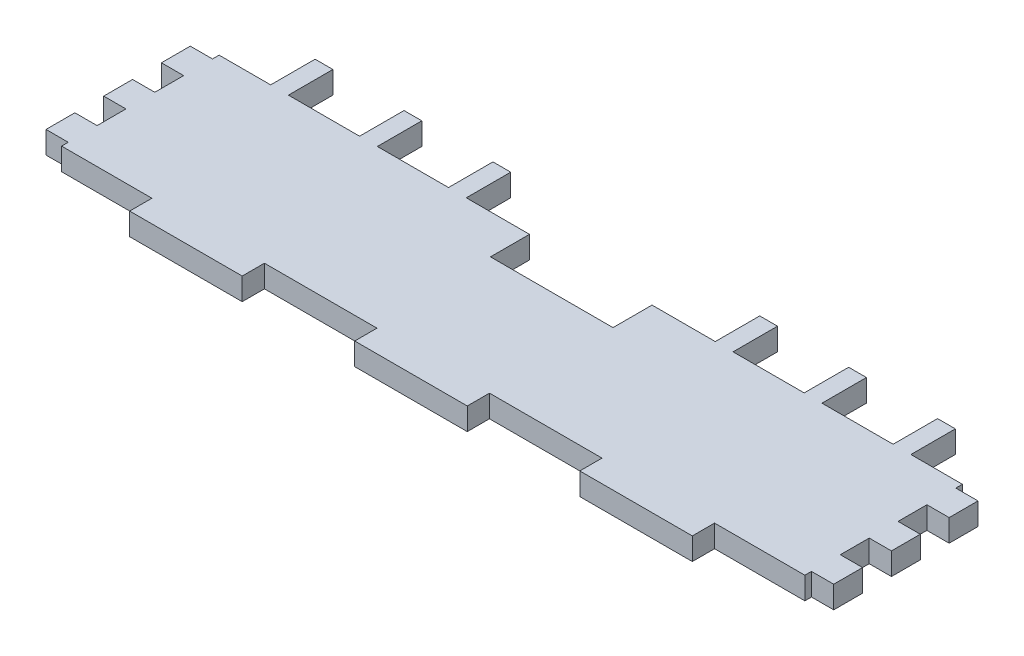
from build123d import *

# Parameters (mm, degrees)
SKETCH1_W           = 32.142857142
SKETCH1_H           = 6.35
SKETCH1_W_2         = 32.142857143
SKETCH1_W_3         = 6.35
SKETCH1_H_2         = 8.242857143
SKETCH1_H_3         = 8.242857142
BOSS_EXTRUDE1_DEPTH = 6.35
SKETCH2_W           = 212.3
SKETCH2_H           = 6.35
SKETCH2_W_2         = 5.08
BOSS_EXTRUDE2_DEPTH = 6.35
SKETCH3_W           = 35
SKETCH3_H           = 23.85
CUT_EXTRUDE1_DEPTH  = 235.025052078
SKETCH4_W           = 14.71
SKETCH4_H           = 6.35
SKETCH4_W_2         = 20.32
CUT_EXTRUDE2_DEPTH  = 6.35
SKETCH5_W           = 20.32
SKETCH5_H           = 6.35
SKETCH5_W_2         = 18.06
CUT_EXTRUDE3_DEPTH  = 235.025052078


with BuildPart() as part:
    # Sketch1 → Boss-Extrude1 (new body)
    with BuildSketch(Plane(origin=(0, 0, 0), x_dir=(1, 0, 0), z_dir=(0, 1, 0))):
        Polygon((6.35, 6.35), (32.142857143, 6.35), (64.285714286, 6.35), (96.428571429, 6.35), (128.571428571, 6.35), (160.714285714, 6.35), (192.857142857, 6.35), (218.65, 6.35), (218.65, 8.242857143), (218.65, 16.485714286), (218.65, 24.728571429), (218.65, 32.971428571), (218.65, 41.214285714), (218.65, 49.457142857), (218.65, 51.35), (192.857142857, 51.35), (160.714285714, 51.35), (128.571428571, 51.35), (96.428571429, 51.35), (64.285714286, 51.35), (32.142857143, 51.35), (6.35, 51.35), (6.35, 49.457142857), (6.35, 41.214285714), (6.35, 32.971428571), (6.35, 24.728571429), (6.35, 16.485714286), (6.35, 8.242857143), align=None)
        with Locations((112.5, 54.525)):
            Rectangle(SKETCH1_W, SKETCH1_H)
        with Locations((112.5, 3.175)):
            Rectangle(SKETCH1_W, SKETCH1_H)
        with Locations((176.785714286, 3.175)):
            Rectangle(SKETCH1_W_2, SKETCH1_H)
        with Locations((176.785714286, 54.525)):
            Rectangle(SKETCH1_W_2, SKETCH1_H)
        with Locations((48.214285715, 54.525)):
            Rectangle(SKETCH1_W_2, SKETCH1_H)
        with Locations((48.214285715, 3.175)):
            Rectangle(SKETCH1_W_2, SKETCH1_H)
        with Locations((3.175, 12.364285714)):
            Rectangle(SKETCH1_W_3, SKETCH1_H_2)
        with Locations((3.175, 28.85)):
            Rectangle(SKETCH1_W_3, SKETCH1_H_3)
        with Locations((3.175, 45.335714286)):
            Rectangle(SKETCH1_W_3, SKETCH1_H_2)
        with Locations((221.825, 12.364285714)):
            Rectangle(SKETCH1_W_3, SKETCH1_H_2)
        with Locations((221.825, 28.85)):
            Rectangle(SKETCH1_W_3, SKETCH1_H_3)
        with Locations((221.825, 45.335714286)):
            Rectangle(SKETCH1_W_3, SKETCH1_H_2)
    extrude(amount=BOSS_EXTRUDE1_DEPTH)

    # Sketch2 → Boss-Extrude2 (add)
    with BuildSketch(Plane(origin=(0, 6.35, 0), x_dir=(1, 0, 0), z_dir=(0, 1, 0))):
        with Locations((112.5, 54.525)):
            Rectangle(SKETCH2_W, SKETCH2_H)
        with Locations((23.6, 60.875)):
            Rectangle(SKETCH2_W_2, SKETCH2_H)
        with Locations((49, 60.875)):
            Rectangle(SKETCH2_W_2, SKETCH2_H)
        with Locations((74.4, 60.875)):
            Rectangle(SKETCH2_W_2, SKETCH2_H)
        with Locations((99.8, 60.875)):
            Rectangle(SKETCH2_W_2, SKETCH2_H)
        with Locations((201.4, 60.875)):
            Rectangle(SKETCH2_W_2, SKETCH2_H)
        with Locations((176, 60.875)):
            Rectangle(SKETCH2_W_2, SKETCH2_H)
        with Locations((125.2, 60.875)):
            Rectangle(SKETCH2_W_2, SKETCH2_H)
        with Locations((150.6, 60.875)):
            Rectangle(SKETCH2_W_2, SKETCH2_H)
    extrude(amount=-BOSS_EXTRUDE2_DEPTH)

    # Sketch3 → Cut-Extrude1 (cut, through all)
    with BuildSketch(Plane(origin=(0, 6.35, 0), x_dir=(1, 0, 0), z_dir=(0, 1, 0))):
        with Locations((112.5, 52.125)):
            Rectangle(SKETCH3_W, SKETCH3_H)
    extrude(amount=-CUT_EXTRUDE1_DEPTH, mode=Mode.SUBTRACT)

    # Sketch4 → Cut-Extrude2 (cut)
    with BuildSketch(Plane(origin=(0, 6.35, 0), x_dir=(1, 0, 0), z_dir=(0, 1, 0))):
        with Locations((13.705, 54.525)):
            Rectangle(SKETCH4_W, SKETCH4_H)
        with Locations((36.3, 54.525)):
            Rectangle(SKETCH4_W_2, SKETCH4_H)
        with Locations((211.295, 54.525)):
            Rectangle(SKETCH4_W, SKETCH4_H)
        with Locations((188.7, 54.525)):
            Rectangle(SKETCH4_W_2, SKETCH4_H)
    extrude(amount=-CUT_EXTRUDE2_DEPTH, mode=Mode.SUBTRACT)

    # Sketch5 → Cut-Extrude3 (cut, through all)
    with BuildSketch(Plane(origin=(0, 6.35, 0), x_dir=(1, 0, 0), z_dir=(0, 1, 0))):
        with Locations((61.7, 54.525)):
            Rectangle(SKETCH5_W, SKETCH5_H)
        with Locations((85.97, 54.525)):
            Rectangle(SKETCH5_W_2, SKETCH5_H)
        with Locations((139.03, 54.525)):
            Rectangle(SKETCH5_W_2, SKETCH5_H)
        with Locations((163.3, 54.525)):
            Rectangle(SKETCH5_W, SKETCH5_H)
    extrude(amount=-CUT_EXTRUDE3_DEPTH, mode=Mode.SUBTRACT)


solid = part.part
